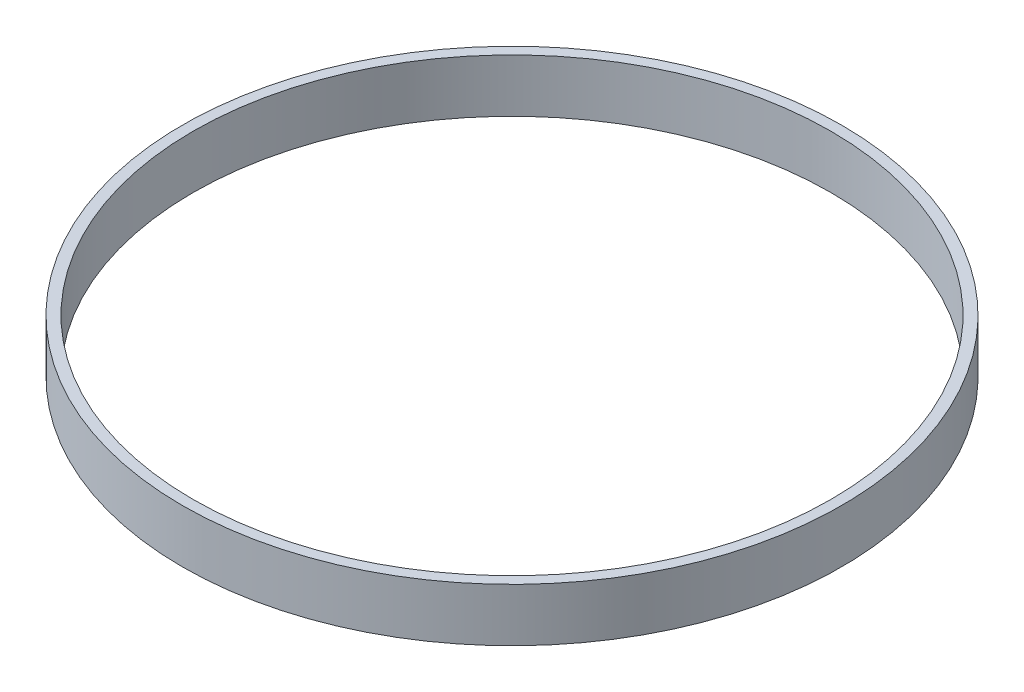
from build123d import *

# Parameters (mm, degrees)
SKETCH1_R           = 15.5
SKETCH1_R_2         = 15
BOSS_EXTRUDE1_DEPTH = 2.5
ECHELLE1_SCALE      = 0.5


with BuildPart() as part:
    # Sketch1 → Boss-Extrude1 (new body)
    with BuildSketch(Plane(origin=(0, 0, 0), x_dir=(1, 0, 0), z_dir=(0, 1, 0))):
        with Locations(Location((0, 0, 0), (0, 0, 270))):
            Circle(SKETCH1_R)
        with Locations(Location((0, 0, 0), (0, 0, 270))):
            Circle(SKETCH1_R_2, mode=Mode.SUBTRACT)
    extrude(amount=BOSS_EXTRUDE1_DEPTH)


with BuildPart() as part_1:
    # Echelle1: scaled about (0, 1.25, 0)
    add(part.part.scale(ECHELLE1_SCALE).moved(Location((0, 0.625, 0))))


solid = part_1.part
